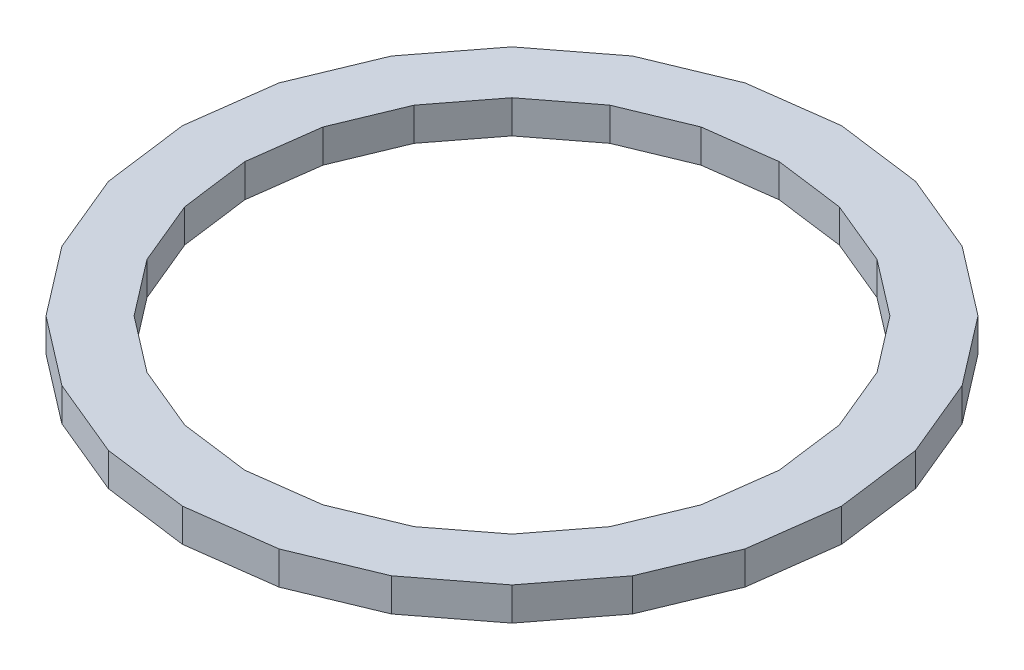
from build123d import *

# Parameters (mm, degrees)
BOSS_EXTRUDE2_DEPTH = 19.05


with BuildPart() as part:
    # Sketch2 → Boss-Extrude2 (new body)
    with BuildSketch(Plane(origin=(0, 0, 0), x_dir=(1, 0, 0), z_dir=(0, 1, 0))):
        Polygon((-189.732034458, 0), (-183.267072158, -49.106263984), (-164.312761753, -94.866017229), (-134.160808174, -134.160808174), (-94.866017229, -164.312761753), (-49.106263984, -183.267072158), (0, -189.732034458), (49.106263984, -183.267072158), (94.866017229, -164.312761753), (134.160808174, -134.160808174), (164.312761753, -94.866017229), (183.267072158, -49.106263984), (189.732034458, 0), (183.267072158, 49.106263984), (164.312761753, 94.866017229), (134.160808174, 134.160808174), (94.866017229, 164.312761753), (49.106263984, 183.267072158), (0, 189.732034458), (-49.106263984, 183.267072158), (-94.866017229, 164.312761753), (-134.160808174, 134.160808174), (-164.312761753, 94.866017229), (-183.267072158, 49.106263984), align=None)
        Polygon((-153.86518862, 0), (-148.622359455, -39.823241193), (-133.251162103, -76.93259431), (-108.799118262, -108.799118262), (-76.93259431, -133.251162103), (-39.823241193, -148.622359455), (0, -153.86518862), (39.823241193, -148.622359455), (76.93259431, -133.251162103), (108.799118262, -108.799118262), (133.251162103, -76.93259431), (148.622359455, -39.823241193), (153.86518862, 0), (148.622359455, 39.823241193), (133.251162103, 76.93259431), (108.799118262, 108.799118262), (76.93259431, 133.251162103), (39.823241193, 148.622359455), (0, 153.86518862), (-39.823241193, 148.622359455), (-76.93259431, 133.251162103), (-108.799118262, 108.799118262), (-133.251162103, 76.93259431), (-148.622359455, 39.823241193), align=None, mode=Mode.SUBTRACT)
    extrude(amount=BOSS_EXTRUDE2_DEPTH)


solid = part.part
